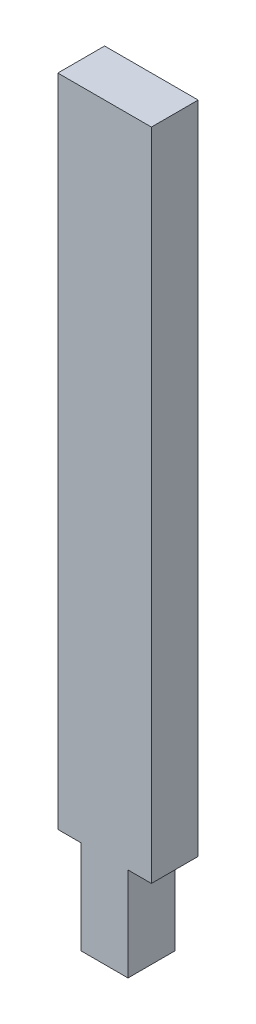
from build123d import *

# Parameters (mm, degrees)
BOSS_EXTRU_1_DEPTH = 5


with BuildPart() as part:
    # Esquisse1 → Boss.-Extru.1 (new body)
    with BuildSketch(Plane.XY):
        Polygon((7.5, 0), (10, 0), (10, 70), (0, 70), (0, 0), (2.5, 0), (2.5, -10), (7.5, -10), align=None)
    extrude(amount=BOSS_EXTRU_1_DEPTH)


solid = part.part
